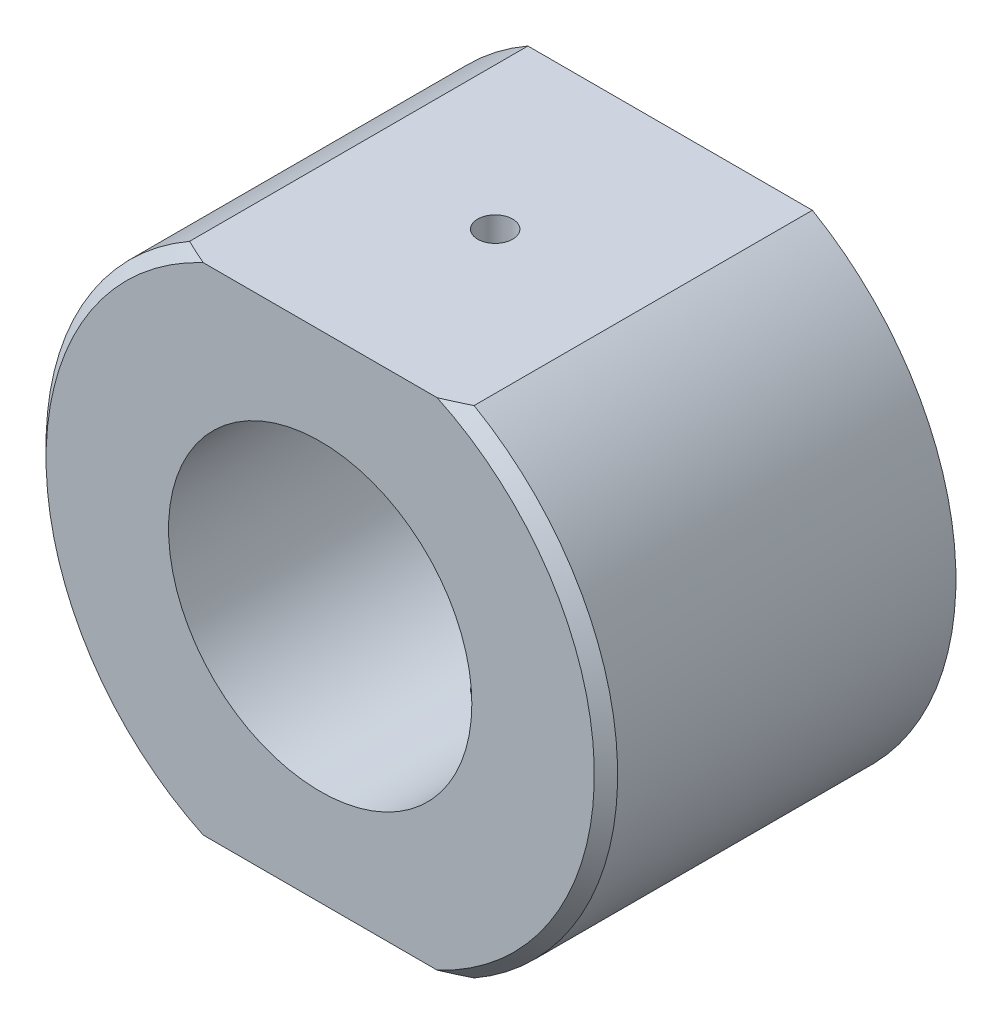
from build123d import *

# Parameters (mm, degrees)
SKETCH1_R               = 26
BOSS_EXTRUDE1_DEPTH     = 60
CHAMFER1_SIZE           = 2
CUT_EXTRUDE1_DEPTH      = 116.004347744
CUT_EXTRUDE1_DEPTH_BACK = 116.004347744
SKETCH2_R               = 3


with BuildPart() as part:
    # Sketch1 → Boss-Extrude1 (new body)
    with BuildSketch(Plane.XY):
        with BuildLine():
            Line((-24.387496797, 42.5), (24.387496797, 42.5))
            ThreePointArc((24.387496797, 42.5), (49, 0), (24.387496797, -42.5))
            Line((24.387496797, -42.5), (-24.387496797, -42.5))
            ThreePointArc((-24.387496797, -42.5), (-49, 0), (-24.387496797, 42.5))
        make_face()
        Circle(SKETCH1_R, mode=Mode.SUBTRACT)
    extrude(amount=BOSS_EXTRUDE1_DEPTH)

    # Chamfer1
    chamfer1_edges = [part.edges().sort_by_distance(p)[0] for p in [
        (49, 0, 60),
        (-49, 0, 60),
    ]]
    chamfer(chamfer1_edges, length=CHAMFER1_SIZE)

    # Sketch2 → Cut-Extrude1 (cut, two sides: drawn at the far end of the back side and taken through both)
    with BuildSketch(Plane(origin=(0, 42.5, 0), x_dir=(1, 0, 0), z_dir=(0, 1, 0)).offset(-CUT_EXTRUDE1_DEPTH_BACK)):
        with Locations(Location((0, -30, 0), (0, 0, 180))):
            Circle(SKETCH2_R)
    extrude(amount=CUT_EXTRUDE1_DEPTH + CUT_EXTRUDE1_DEPTH_BACK, mode=Mode.SUBTRACT)


solid = part.part
